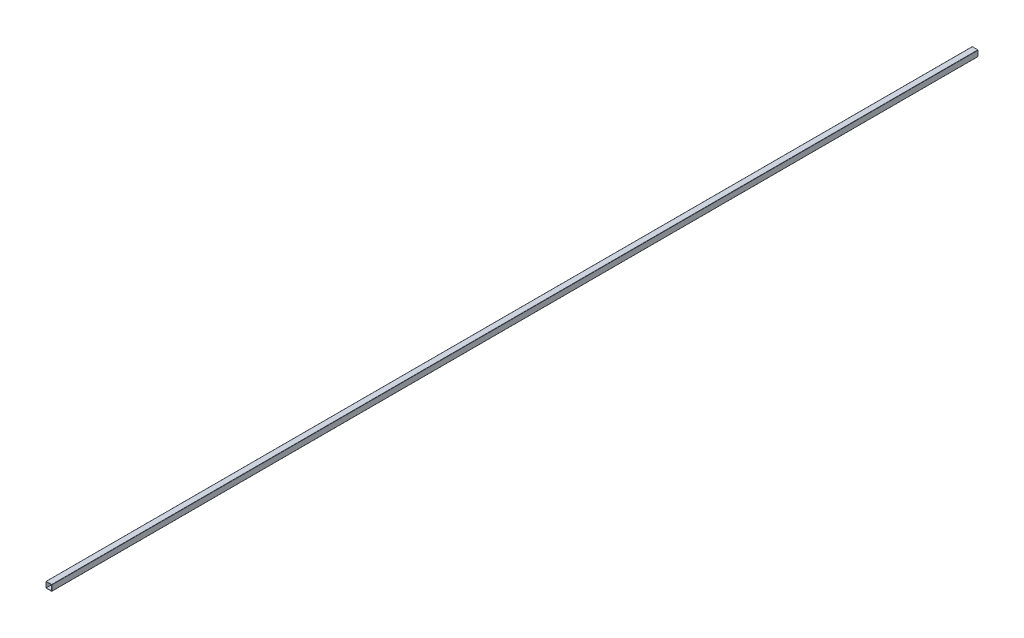
from build123d import *

# Parameters (mm, degrees)
CROQUIS1_W              = 35.1
CROQUIS1_H              = 35.1
SALIENTE_EXTRUIR1_DEPTH = 6000


with BuildPart() as part:
    # Croquis1 → Saliente-Extruir1 (new body)
    with BuildSketch(Plane.XY):
        with BuildLine():
            Line((-17.55, -19.05), (17.55, -19.05))
            ThreePointArc((17.55, -19.05), (18.610660172, -18.610660172), (19.05, -17.55))
            Line((19.05, -17.55), (19.05, 17.55))
            ThreePointArc((19.05, 17.55), (18.610660172, 18.610660172), (17.55, 19.05))
            Line((17.55, 19.05), (-17.55, 19.05))
            ThreePointArc((-17.55, 19.05), (-18.610660172, 18.610660172), (-19.05, 17.55))
            Line((-19.05, 17.55), (-19.05, -17.55))
            ThreePointArc((-19.05, -17.55), (-18.610660172, -18.610660172), (-17.55, -19.05))
        make_face()
        Rectangle(CROQUIS1_W, CROQUIS1_H, mode=Mode.SUBTRACT)
    extrude(amount=SALIENTE_EXTRUIR1_DEPTH)


solid = part.part
